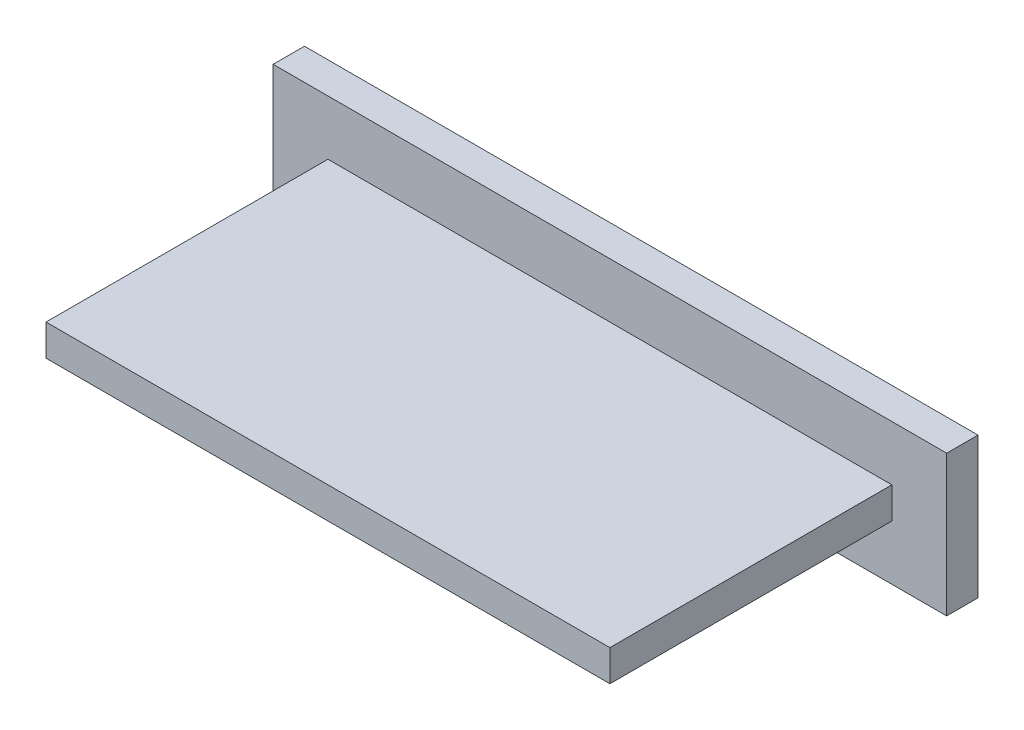
from build123d import *

# Parameters (mm, degrees)
CROQUIS1_W              = 86
CROQUIS1_H              = 18
SALIENTE_EXTRUIR1_DEPTH = 4
CROQUIS2_W              = 72
CROQUIS2_H              = 4
SALIENTE_EXTRUIR2_DEPTH = 36


with BuildPart() as part:
    # Croquis1 → Saliente-Extruir1 (new body)
    with BuildSketch(Plane.XY):
        with Locations((43, -9)):
            Rectangle(CROQUIS1_W, CROQUIS1_H)
    extrude(amount=SALIENTE_EXTRUIR1_DEPTH)

    # Croquis2 → Saliente-Extruir2 (add)
    with BuildSketch(Plane.XY.offset(4)):
        with Locations((43, -9)):
            Rectangle(CROQUIS2_W, CROQUIS2_H)
    extrude(amount=SALIENTE_EXTRUIR2_DEPTH)


solid = part.part
